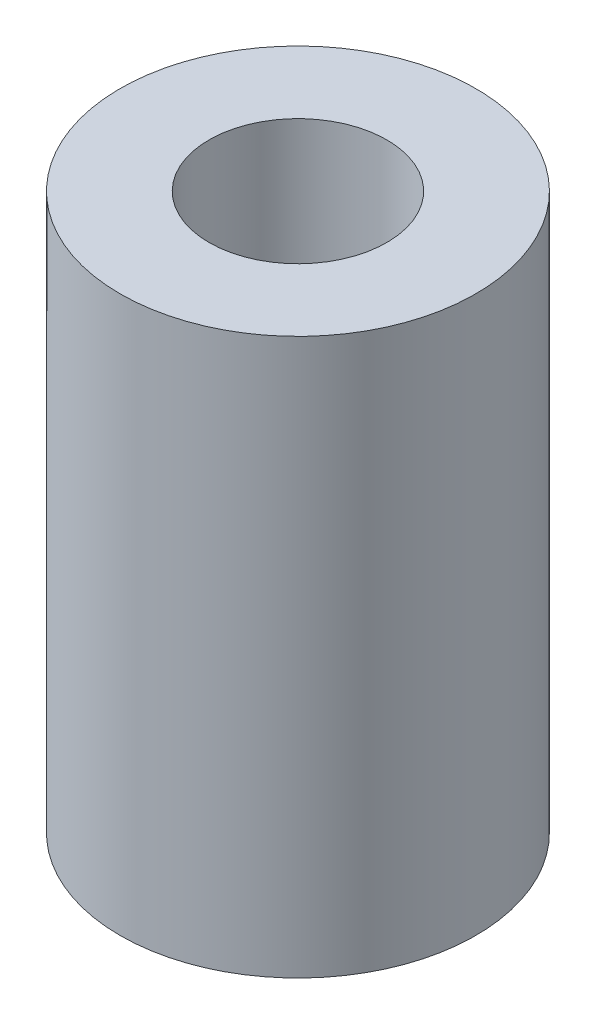
from build123d import *

# Parameters (mm, degrees)
SKETCH_1_R          = 8
EXTRUDE_1_DEPTH     = 25
SKETCH_2_R          = 4
CUT_EXTRUDE_1_DEPTH = 15
SKETCH_3_R          = 2.5
CUT_EXTRUDE_2_DEPTH = 3


with BuildPart() as part:
    # 草图1 → 凸台-拉伸1 (new body)
    with BuildSketch(Plane(origin=(0, 0, 0), x_dir=(1, 0, 0), z_dir=(0, 1, 0))):
        with Locations(Location((0, 0, 0), (0, 0, 270))):
            Circle(SKETCH_1_R)
    extrude(amount=EXTRUDE_1_DEPTH)

    # 草图2 → 切除-拉伸1 (cut)
    with BuildSketch(Plane(origin=(0, 25, 0), x_dir=(1, 0, 0), z_dir=(0, 1, 0))):
        with Locations(Location((0, 0, 0), (0, 0, 270))):
            Circle(SKETCH_2_R)
    extrude(amount=-CUT_EXTRUDE_1_DEPTH, mode=Mode.SUBTRACT)

    # 草图3 → 切除-拉伸2 (cut)
    with BuildSketch(Plane.XZ):
        with Locations(Location((0, 0, 0), (0, 0, 270))):
            Circle(SKETCH_3_R)
    extrude(amount=-CUT_EXTRUDE_2_DEPTH, mode=Mode.SUBTRACT)


solid = part.part
